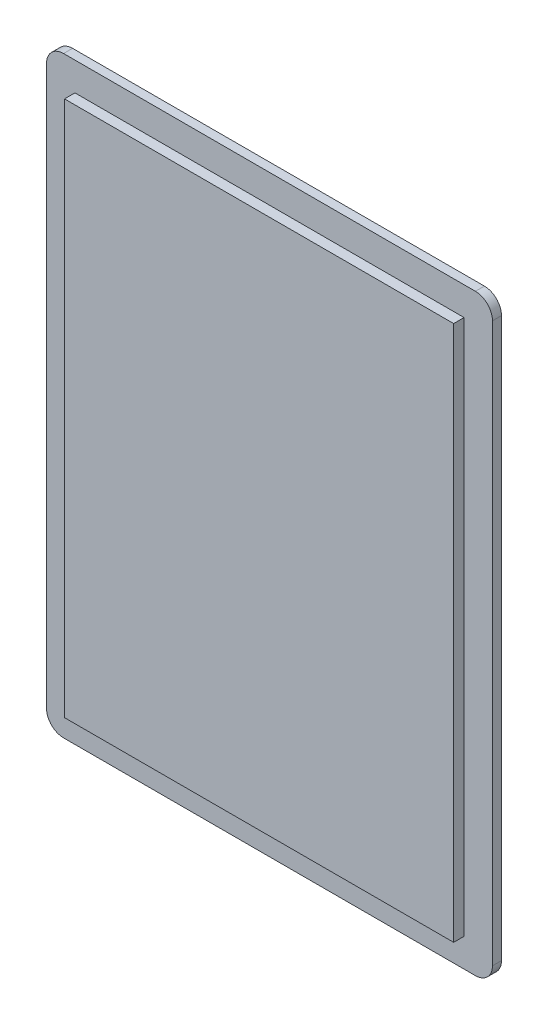
from build123d import *

# Parameters (mm, degrees)
SKETCH_1_W      = 471
SKETCH_1_H      = 626
EXTRUDE_1_DEPTH = 4.75
FILLET_1_R      = 18
SKETCH_2_W      = 411
SKETCH_2_H      = 566
EXTRUDE_2_DEPTH = 11


with BuildPart() as part:
    # Эскиз1 → Бобышка-Вытянуть1 (new, symmetric)
    with BuildSketch(Plane.XY):
        Rectangle(SKETCH_1_W, SKETCH_1_H)
    extrude(amount=EXTRUDE_1_DEPTH, both=True)

    # Скругление1
    fillet_1_edges = [part.edges().sort_by_distance(p)[0] for p in [
        (235.5, -313, 0),
        (-235.5, -313, 0),
        (-235.5, 313, 0),
        (235.5, 313, 0),
    ]]
    fillet(fillet_1_edges, radius=FILLET_1_R)

    # Эскиз2 → Бобышка-Вытянуть2 (add)
    with BuildSketch(Plane.XY.offset(4.75)):
        Rectangle(SKETCH_2_W, SKETCH_2_H)
    extrude(amount=EXTRUDE_2_DEPTH)


solid = part.part
